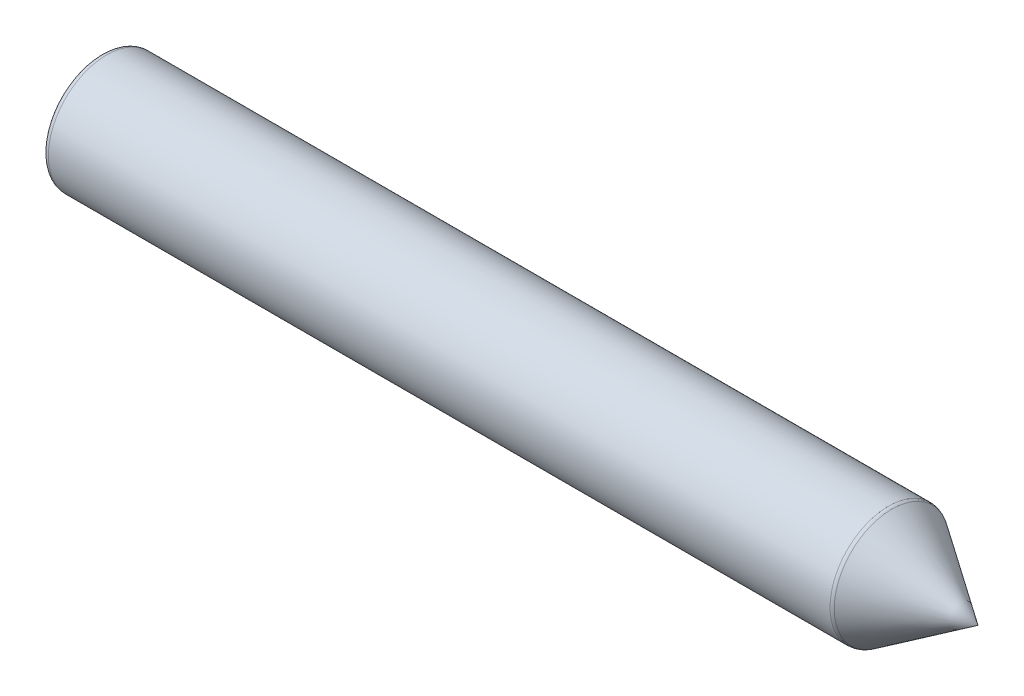
from build123d import *

# Parameters (mm, degrees)
FILLET1_R = 1


with BuildPart() as part:
    # Sketch1 → Revolve1 (revolve)
    with BuildSketch(Plane(origin=(0, 0, 0), x_dir=(1, 0, 0), z_dir=(0, 1, 0)), mode=Mode.PRIVATE) as revolve1_sk:
        Polygon((0, 0), (0, 10), (135, 10), (150, 0), align=None)
    revolve(revolve1_sk.sketch.rotate(Axis((0, 0, 0), (1, 0, 0)), 180), axis=Axis((0, 0, 0), (1, 0, 0)))

    # Fillet1
    fillet1_edges = [part.edges().sort_by_distance(p)[0] for p in [
        (0, 0, -10),
        (135, 0, -10),
    ]]
    fillet(fillet1_edges, radius=FILLET1_R)


solid = part.part
